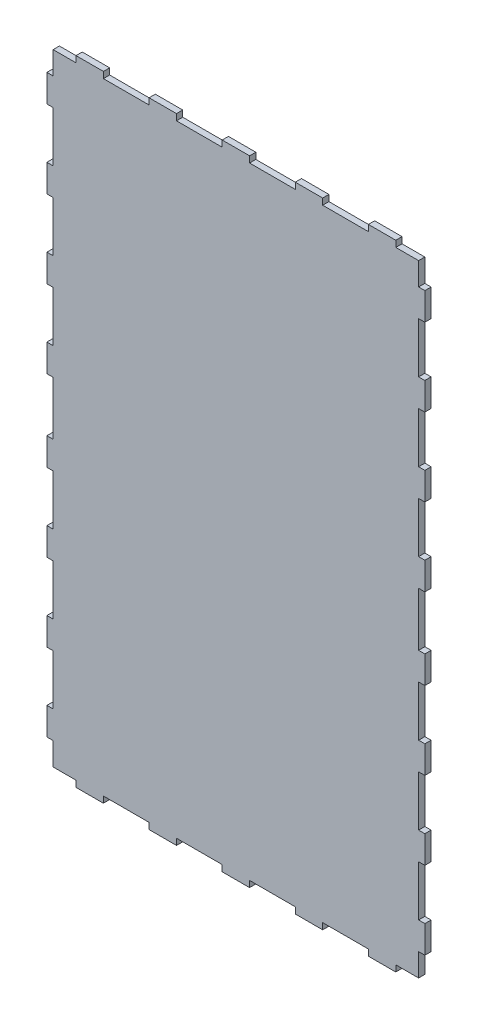
from build123d import *

# Parameters (mm, degrees)
SKETCH1_W                 = 254
SKETCH1_H                 = 431.8
BOSS_EXTRUDE1_DEPTH       = 4.3434
SKETCH2_W                 = 8.6868
SKETCH2_H                 = 19.05
SKETCH2_W_2               = 19.05
SKETCH2_H_2               = 8.6868
BOSS_EXTRUDE2_DEPTH       = 4.3434
MIRROR2_COPY_1_SKETCH_W   = 8.6868
MIRROR2_COPY_1_SKETCH_H   = 19.05
MIRROR2_COPY_1_SKETCH_W_2 = 19.05
MIRROR2_COPY_1_SKETCH_H_2 = 8.6868
MIRROR2_COPY_1_DEPTH      = 4.3434


with BuildPart() as part:
    # Sketch1 → Boss-Extrude1 (new body)
    with BuildSketch(Plane.XY):
        Rectangle(SKETCH1_W, SKETCH1_H)
    extrude(amount=BOSS_EXTRUDE1_DEPTH)

    # Sketch2 → Boss-Extrude2 (add)
    with BuildSketch(Plane.XY.offset(4.3434)):
        with Locations((-127, 190.5)):
            Rectangle(SKETCH2_W, SKETCH2_H)
        with Locations((-101.6, 215.9)):
            Rectangle(SKETCH2_W_2, SKETCH2_H_2)
        with Locations((-50.8, 215.9)):
            Rectangle(SKETCH2_W_2, SKETCH2_H_2)
        with Locations((0, 215.9)):
            Rectangle(SKETCH2_W_2, SKETCH2_H_2)
        with Locations((50.8, 215.9)):
            Rectangle(SKETCH2_W_2, SKETCH2_H_2)
        with Locations((101.6, 215.9)):
            Rectangle(SKETCH2_W_2, SKETCH2_H_2)
        with Locations((-127, 136.398)):
            Rectangle(SKETCH2_W, SKETCH2_H)
        with Locations((-127, 82.296)):
            Rectangle(SKETCH2_W, SKETCH2_H)
        with Locations((-127, 28.194)):
            Rectangle(SKETCH2_W, SKETCH2_H)
    boss_extrude2 = extrude(amount=-BOSS_EXTRUDE2_DEPTH)

    # Mirror1: Boss-Extrude2 across plane
    add(boss_extrude2.mirror(Plane(origin=(0, 0, 0), x_dir=(0, 0, 1), z_dir=(1, 0, 0))))

    # Mirror2: Boss-Extrude2 across plane
    add(boss_extrude2.mirror(Plane.ZX))

    # Mirror2 copy 1 sketch → Mirror2 copy 1 (add)
    with BuildSketch(Plane(origin=(0, 0, 4.3434), x_dir=(-1, 0, 0), z_dir=(0, 0, 1))):
        with Locations((-127, 190.5)):
            Rectangle(MIRROR2_COPY_1_SKETCH_W, MIRROR2_COPY_1_SKETCH_H)
        with Locations((-101.6, 215.9)):
            Rectangle(MIRROR2_COPY_1_SKETCH_W_2, MIRROR2_COPY_1_SKETCH_H_2)
        with Locations((-50.8, 215.9)):
            Rectangle(MIRROR2_COPY_1_SKETCH_W_2, MIRROR2_COPY_1_SKETCH_H_2)
        with Locations((0, 215.9)):
            Rectangle(MIRROR2_COPY_1_SKETCH_W_2, MIRROR2_COPY_1_SKETCH_H_2)
        with Locations((50.8, 215.9)):
            Rectangle(MIRROR2_COPY_1_SKETCH_W_2, MIRROR2_COPY_1_SKETCH_H_2)
        with Locations((101.6, 215.9)):
            Rectangle(MIRROR2_COPY_1_SKETCH_W_2, MIRROR2_COPY_1_SKETCH_H_2)
        with Locations((-127, 136.398)):
            Rectangle(MIRROR2_COPY_1_SKETCH_W, MIRROR2_COPY_1_SKETCH_H)
        with Locations((-127, 82.296)):
            Rectangle(MIRROR2_COPY_1_SKETCH_W, MIRROR2_COPY_1_SKETCH_H)
        with Locations((-127, 28.194)):
            Rectangle(MIRROR2_COPY_1_SKETCH_W, MIRROR2_COPY_1_SKETCH_H)
    extrude(amount=-MIRROR2_COPY_1_DEPTH)


solid = part.part
